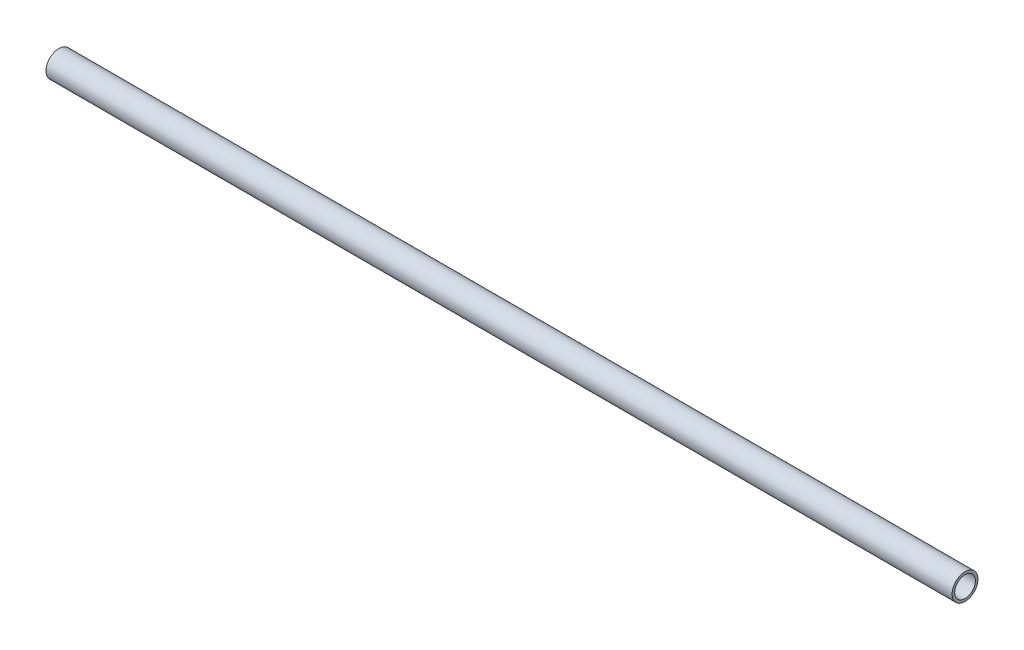
from build123d import *

# Parameters (mm, degrees)
SKETCH1_R           = 5
SKETCH1_R_2         = 4
BOSS_EXTRUDE1_DEPTH = 350


with BuildPart() as part:
    # Sketch1 → Boss-Extrude1 (new body)
    with BuildSketch(Plane(origin=(0, 0, 0), x_dir=(0, 0, -1), z_dir=(1, 0, 0))):
        Circle(SKETCH1_R)
        Circle(SKETCH1_R_2, mode=Mode.SUBTRACT)
    extrude(amount=BOSS_EXTRUDE1_DEPTH)


solid = part.part
